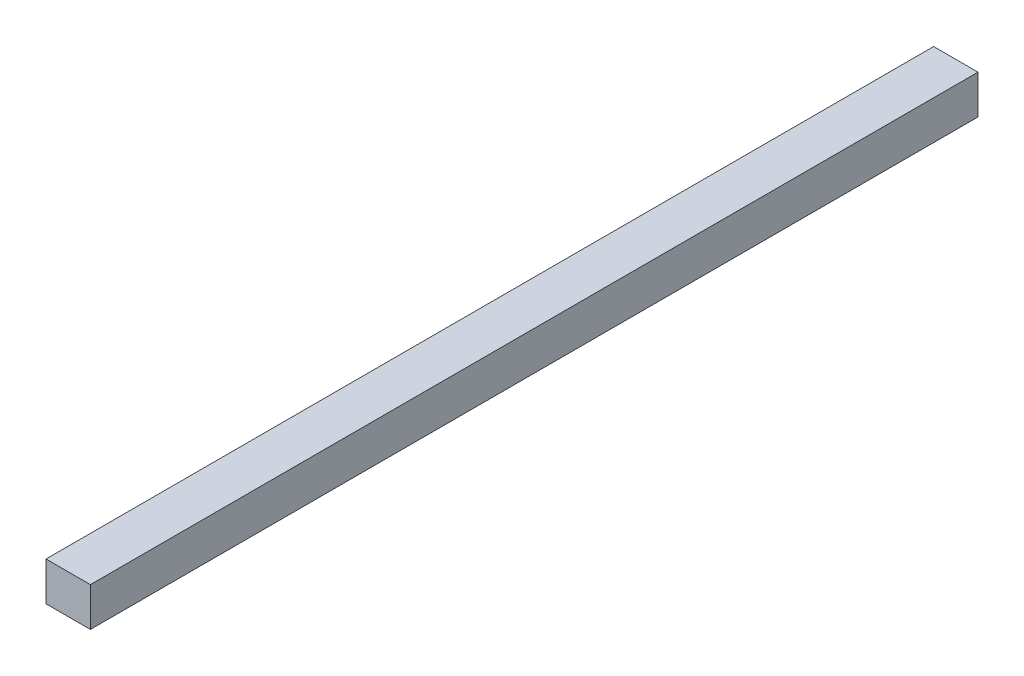
from build123d import *

# Parameters (mm, degrees)
SKETCH1_W           = 2
SKETCH1_H           = 40
BOSS_EXTRUDE1_DEPTH = 1.75
SCALE1_SCALE        = 10


with BuildPart() as part:
    # Sketch1 → Boss-Extrude1 (new body)
    with BuildSketch(Plane(origin=(0, 0, 0), x_dir=(1, 0, 0), z_dir=(0, 1, 0))):
        with Locations((33.496472393, 14.496472393)):
            Rectangle(SKETCH1_W, SKETCH1_H)
    extrude(amount=BOSS_EXTRUDE1_DEPTH)


with BuildPart() as part_1:
    # Scale1: scaled about (33.496472393, 0.875, -14.496472393)
    add(part.part.scale(SCALE1_SCALE).moved(Location((-301.468251537, -7.875, 130.468251537))))


solid = part_1.part
